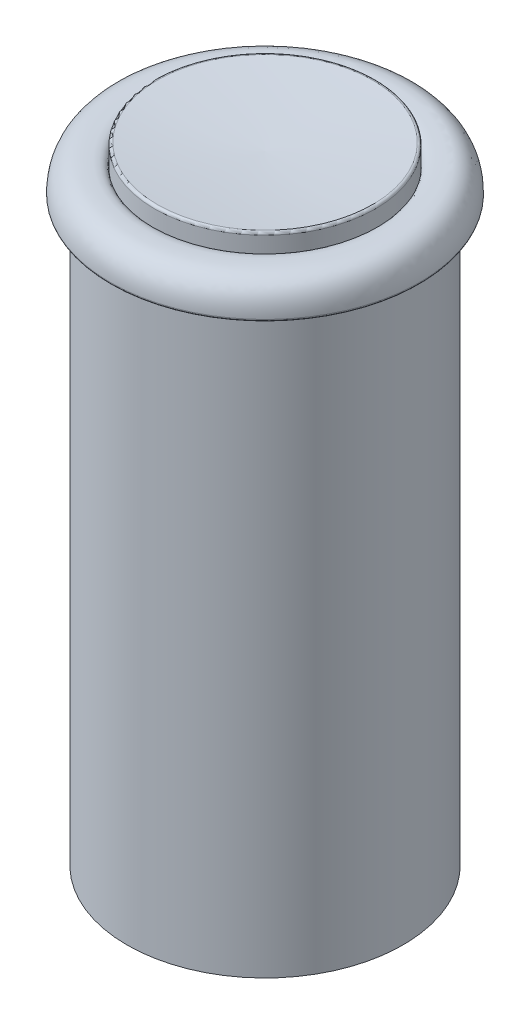
from build123d import *

# Parameters (mm, degrees)
SKETCH1_R           = 16
BOSS_EXTRUDE1_DEPTH = 65
SKETCH2_W           = 1.7125
SKETCH2_H           = 60
FILLET1_R           = 0.254


with BuildPart() as part:
    # Sketch1 → Boss-Extrude1 (new body)
    with BuildSketch(Plane(origin=(0, 0, 0), x_dir=(1, 0, 0), z_dir=(0, 1, 0))):
        with Locations(Location((0, 0, 0), (0, 0, 270))):
            Circle(SKETCH1_R)
    extrude(amount=BOSS_EXTRUDE1_DEPTH)

    # Sketch2 → Cut-Revolve1 (revolve, cut)
    with BuildSketch(Plane.XY, mode=Mode.PRIVATE) as cut_revolve1_sk:
        with Locations((15.14375, 30)):
            Rectangle(SKETCH2_W, SKETCH2_H)
        with BuildLine():
            Line((11.43, 64.854289512), (11.43, 62.5))
            add(Edge.make_bspline(
                [(11.43, 62.5), (11.43, 63.380128895), (12.66611498, 63.304888628), (14.372393812, 63.395389565), (16, 62.598928516), (16, 60.169900087)],
                knots=[0, 0, 0, 0, 0.469325329, 0.569325329, 1, 1, 1, 1], degree=3))
            Line((16, 60.169900087), (16, 65))
            Line((16, 65), (9.372618371, 65))
            Line((9.372618371, 65), (0, 65))
            Line((0, 65), (0, 64.022751884))
            ThreePointArc((0, 64.022751884), (5.723360345, 64.323602573), (11.43, 64.854289512))
        make_face()
    revolve(cut_revolve1_sk.sketch.rotate(Axis((0, 65, 0), (0, -1, 0)), 90), axis=Axis((0, 65, 0), (0, -1, 0)), mode=Mode.SUBTRACT)

    # Fillet1
    fillet1_edges = [part.edges().sort_by_distance(p)[0] for p in [
        (0, 60, -16),
        (0, 60, -14.2875),
        (0, 64.854289512, -11.43),
    ]]
    fillet(fillet1_edges, radius=FILLET1_R)


solid = part.part
